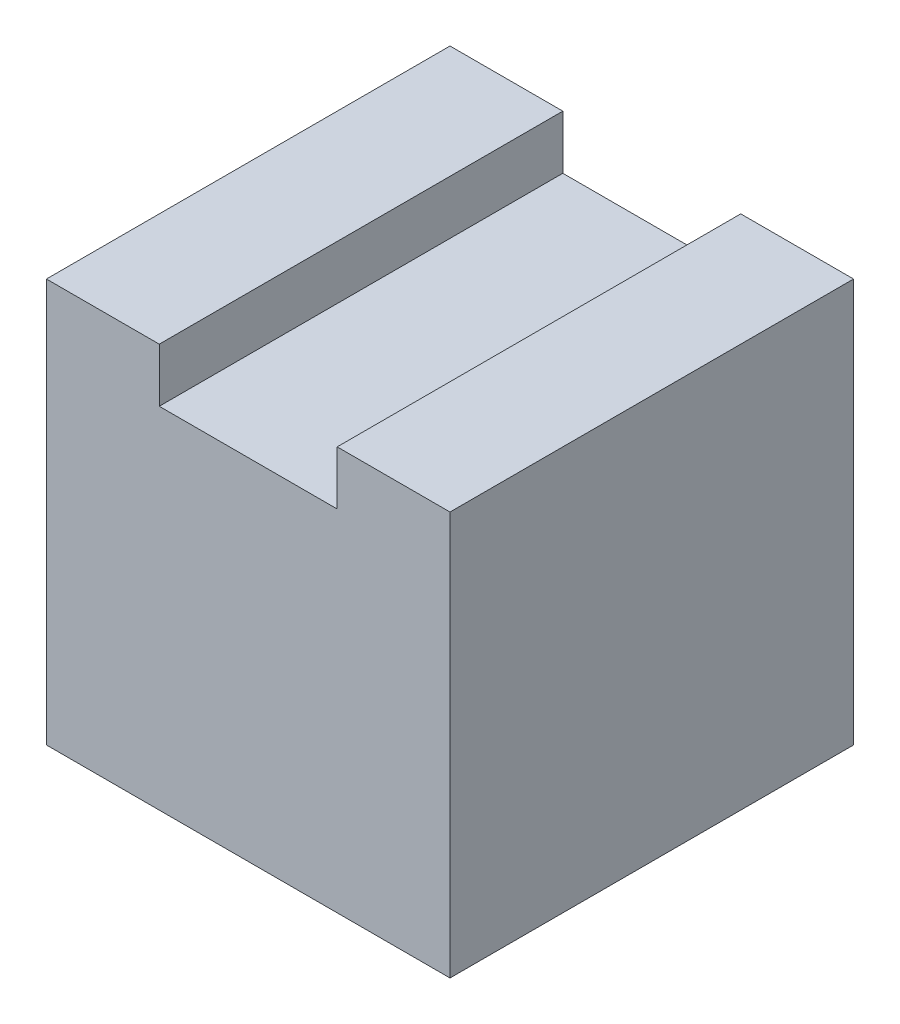
from build123d import *

# Parameters (mm, degrees)
SKETCH1_W           = 300
SKETCH1_H           = 300
BOSS_EXTRUDE1_DEPTH = 300
SKETCH3_R           = 79.895545122
CUT_EXTRUDE1_DEPTH  = 100
SKETCH8_R           = 50
CUT_EXTRUDE3_DEPTH  = 100
SKETCH9_W           = 73.610989956
SKETCH9_H           = 275.007350114
CUT_EXTRUDE4_DEPTH  = 80
SKETCH11_W          = 132.256824298
SKETCH11_H          = 300
CUT_EXTRUDE6_DEPTH  = 40


with BuildPart() as part:
    # Sketch1 → Boss-Extrude1 (new body)
    with BuildSketch(Plane(origin=(0, 0, 0), x_dir=(1, 0, 0), z_dir=(0, 1, 0))):
        Rectangle(SKETCH1_W, SKETCH1_H)
    extrude(amount=BOSS_EXTRUDE1_DEPTH)

    # Sketch3 → Cut-Extrude1 (cut)
    with BuildSketch(Plane(origin=(0, 0, 0), x_dir=(1, 0, 0), z_dir=(0, 1, 0))):
        with Locations(Location((-63.272367771, -59.757236228, 0), (0, 0, 270))):
            Circle(SKETCH3_R)
    extrude(amount=CUT_EXTRUDE1_DEPTH, mode=Mode.SUBTRACT)

    # Sketch8 → Cut-Extrude3 (cut)
    with BuildSketch(Plane.XZ):
        with Locations(Location((-70.716175744, -86.224109021, 0), (0, 0, 270))):
            Circle(SKETCH8_R)
    extrude(amount=-CUT_EXTRUDE3_DEPTH, mode=Mode.SUBTRACT)

    # Sketch9 → Cut-Extrude4 (cut)
    with BuildSketch(Plane.XZ):
        with Locations((91.393420113, 0)):
            Rectangle(SKETCH9_W, SKETCH9_H)
    extrude(amount=-CUT_EXTRUDE4_DEPTH, mode=Mode.SUBTRACT)

    # Sketch11 → Cut-Extrude6 (cut)
    with BuildSketch(Plane(origin=(0, 300, 0), x_dir=(1, 0, 0), z_dir=(0, 1, 0))):
        Rectangle(SKETCH11_W, SKETCH11_H)
    extrude(amount=-CUT_EXTRUDE6_DEPTH, mode=Mode.SUBTRACT)


solid = part.part
